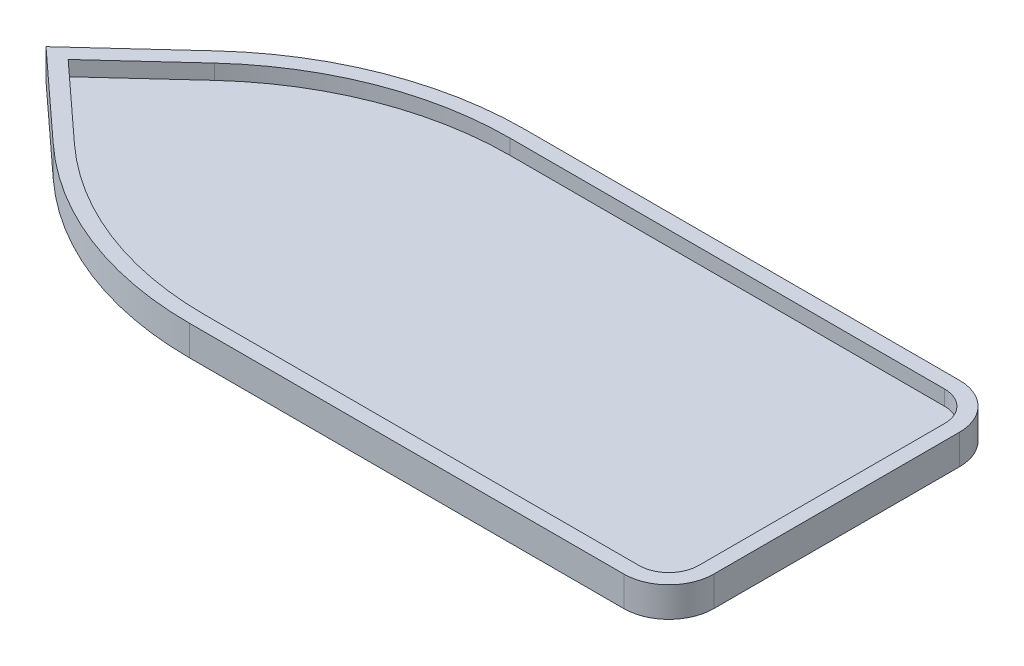
from build123d import *

# Parameters (mm, degrees)
BOSS_EXTRUDE1_DEPTH = 10
SHELL1_T            = -5


with BuildPart() as part:
    # Sketch1 → Boss-Extrude1 (new body)
    with BuildSketch(Plane(origin=(0, 0, 0), x_dir=(1, 0, 0), z_dir=(0, 1, 0))):
        with BuildLine():
            Line((0, -15), (0, -97))
            ThreePointArc((0, -97), (-4.393398282, -107.606601718), (-15, -112))
            Line((-15, -112), (-160, -112))
            ThreePointArc((-160, -112), (-199.906147513, -104.506094408), (-234.374969534, -83.045443467))
            Line((-234.374969534, -83.045443467), (-263.846039886, -56))
            Line((-263.846039886, -56), (-234.374969534, -28.954556533))
            ThreePointArc((-234.374969534, -28.954556533), (-199.906147513, -7.493905592), (-160, 0))
            Line((-160, 0), (-15, 0))
            ThreePointArc((-15, 0), (-4.393398282, -4.393398282), (0, -15))
        make_face()
    extrude(amount=BOSS_EXTRUDE1_DEPTH)

    # Shell1
    shell1_openings = [part.faces().sort_by_distance(p)[0] for p in [
        (-116.342811862, 10, 56),
    ]]
    offset(amount=SHELL1_T, openings=shell1_openings, kind=Kind.INTERSECTION)


solid = part.part
